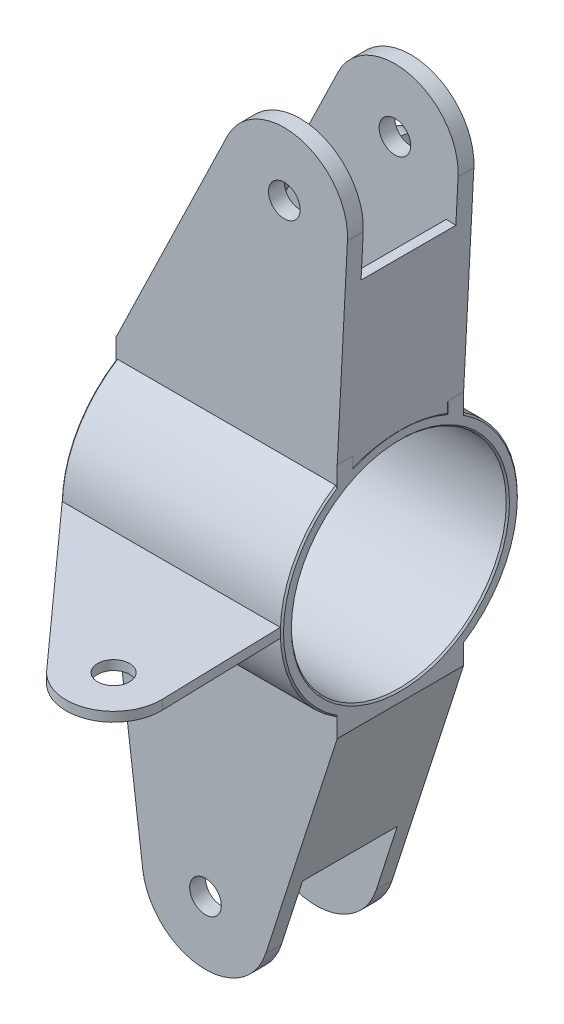
from build123d import *

# Parameters (mm, degrees)
SKETCH1_R             = 37.5
SKETCH1_R_2           = 34.007
BOSS_EXTRUDE1_DEPTH   = 35
BOSS_EXTRUDE2_START   = 15
SKETCH4_R             = 5.007
BOSS_EXTRUDE2_DEPTH   = 5
BOSS_EXTRUDE2_2_DEPTH = 5
BOSS_EXTRUDE3_START   = -15
SKETCH5_R             = 5.007
BOSS_EXTRUDE3_DEPTH   = 5
BOSS_EXTRUDE3_2_DEPTH = 5
BOSS_EXTRUDE4_DEPTH   = 70
CHAMFER1_SIZE         = 0.5
CHAMFER2_SIZE         = 0.5
BOSS_EXTRUDE8_DEPTH   = 3
SKETCH13_W            = 30
SKETCH13_H            = 55
BOSS_EXTRUDE9_DEPTH   = 3
BOSS_EXTRUDE10_DEPTH  = 3
SKETCH15_W            = 30
SKETCH15_H            = 50
BOSS_EXTRUDE11_DEPTH  = 3
BOSS_EXTRUDE12_DEPTH  = 3
SKETCH17_W            = 30
SKETCH17_H            = 52
BOSS_EXTRUDE13_DEPTH  = 3
BOSS_EXTRUDE14_DEPTH  = 3
SKETCH22_R            = 5.05
BOSS_EXTRUDE16_DEPTH  = 1.5
BOSS_EXTRUDE17_START  = -4
SKETCH23_R            = 3
BOSS_EXTRUDE17_DEPTH  = 4


with BuildPart() as part:
    # Sketch1 → Boss-Extrude1 (new, symmetric)
    with BuildSketch(Plane(origin=(0, 0, 0), x_dir=(0, 0, -1), z_dir=(1, 0, 0))):
        Circle(SKETCH1_R)
        Circle(SKETCH1_R_2, mode=Mode.SUBTRACT)
    extrude(amount=BOSS_EXTRUDE1_DEPTH, both=True)



with BuildPart() as body_2:
    # Sketch4 → Boss-Extrude2 (new body)
    with BuildSketch(Plane.XY.offset(BOSS_EXTRUDE2_START)):
        with BuildLine():
            Line((0.275652512, 110.319327951), (-35, 37.5))
            Line((-35, 37.5), (35, 37.5))
            Line((35, 37.5), (38.248437197, 100.571279081))
            ThreePointArc((38.248437197, 100.571279081), (23.247893056, 120.971872737), (0.275652512, 110.319327951))
        make_face()
        with Locations((18.274911388, 101.6)):
            Circle(SKETCH4_R, mode=Mode.SUBTRACT)
    extrude(amount=BOSS_EXTRUDE2_DEPTH)


with BuildPart() as body_3:
    # Sketch4 → Boss-Extrude2 2 (new body)
    with BuildSketch(Plane.XY.offset(BOSS_EXTRUDE2_START)):
        with BuildLine():
            Line((-35, -37.5), (-26.514661672, -104.126718952))
            ThreePointArc((-26.514661672, -104.126718952), (-8.523708177, -121.514365429), (12.360633821, -107.735798124))
            Line((12.360633821, -107.735798124), (35, -37.5))
            Line((35, -37.5), (-35, -37.5))
        make_face()
        with Locations((-6.674911388, -101.6)):
            Circle(SKETCH4_R, mode=Mode.SUBTRACT)
    extrude(amount=BOSS_EXTRUDE2_2_DEPTH)


with BuildPart() as body_4:
    # Sketch5 → Boss-Extrude3 (new body)
    with BuildSketch(Plane.XY.offset(BOSS_EXTRUDE3_START)):
        with BuildLine():
            Line((35, -37.5), (-35, -37.5))
            Line((-35, -37.5), (-26.514661672, -104.126718952))
            ThreePointArc((-26.514661672, -104.126718952), (-8.523708177, -121.514365429), (12.360633821, -107.735798124))
            Line((12.360633821, -107.735798124), (35, -37.5))
        make_face()
        with Locations((-6.674911388, -101.6)):
            Circle(SKETCH5_R, mode=Mode.SUBTRACT)
    extrude(amount=-BOSS_EXTRUDE3_DEPTH)


with BuildPart() as body_5:
    # Sketch5 → Boss-Extrude3 2 (new body)
    with BuildSketch(Plane.XY.offset(BOSS_EXTRUDE3_START)):
        with BuildLine():
            Line((35, 37.5), (38.248437197, 100.571279081))
            ThreePointArc((38.248437197, 100.571279081), (23.247893056, 120.971872737), (0.275652512, 110.319327951))
            Line((0.275652512, 110.319327951), (-35, 37.5))
            Line((-35, 37.5), (35, 37.5))
        make_face()
        with Locations((18.274911388, 101.6)):
            Circle(SKETCH5_R, mode=Mode.SUBTRACT)
    extrude(amount=-BOSS_EXTRUDE3_2_DEPTH)


with BuildPart() as part_1:
    add(part.part)

    add(body_2.part)  # Boss-Extrude4 merges body 2

    add(body_3.part)  # Boss-Extrude4 merges body 3

    add(body_4.part)  # Boss-Extrude4 merges body 4

    add(body_5.part)  # Boss-Extrude4 merges body 5
    # Sketch6 → Boss-Extrude4 (add)
    with BuildSketch(Plane(origin=(35, 0, 0), x_dir=(0, 0, -1), z_dir=(1, 0, 0))):
        with BuildLine():
            Line((20, -37.5), (15, -37.5))
            Line((15, -37.5), (15, -34.369317712))
            ThreePointArc((15, -34.369317712), (17.550008803, -33.139812779), (20, -31.721443851))
            Line((20, -31.721443851), (20, -37.5))
        make_face()
        with BuildLine():
            Line((-20, -37.5), (-15, -37.5))
            Line((-15, -37.5), (-15, -34.369317712))
            ThreePointArc((-15, -34.369317712), (-17.550008803, -33.139812779), (-20, -31.721443851))
            Line((-20, -31.721443851), (-20, -37.5))
        make_face()
        with BuildLine():
            Line((20, 37.5), (15, 37.5))
            Line((15, 37.5), (15, 34.369317712))
            ThreePointArc((15, 34.369317712), (17.550008803, 33.139812779), (20, 31.721443851))
            Line((20, 31.721443851), (20, 37.5))
        make_face()
        with BuildLine():
            Line((-20, 37.5), (-15, 37.5))
            Line((-15, 37.5), (-15, 34.369317712))
            ThreePointArc((-15, 34.369317712), (-17.550008803, 33.139812779), (-20, 31.721443851))
            Line((-20, 31.721443851), (-20, 37.5))
        make_face()
    extrude(amount=-BOSS_EXTRUDE4_DEPTH)

    # Chamfer1
    chamfer1_edges = [part_1.edges().sort_by_distance(p)[0] for p in [
        (35, -37.5, 0),
        (35, 37.5, 0),
        (35, 0, 34.007),
        (35, 0, 37.5),
        (35, 0, -37.5),
    ]]
    chamfer(chamfer1_edges, length=CHAMFER1_SIZE)

    # Chamfer2
    chamfer2_edges = [part_1.edges().sort_by_distance(p)[0] for p in [
        (-35, 0, -37.5),
        (-35, -37.5, 0),
        (-35, 37.5, 0),
        (-35, 0, 34.007),
        (-35, 0, 37.5),
    ]]
    chamfer(chamfer2_edges, length=CHAMFER2_SIZE)

    # Sketch12 → Boss-Extrude8 (add)
    with BuildSketch(Plane(origin=(32.981103177, -1.69866608, 0), x_dir=(0, 0, -1), z_dir=(0.9986762904840372, -0.05143604597014742, 0))):
        with BuildLine():
            Line((-15, 39.250622502), (-15, 88.751284357))
            Line((-15, 88.751284357), (15, 88.751284357))
            Line((15, 88.751284357), (15, 39.250622502))
            Line((15, 39.250622502), (15, 35.578558741))
            add(Edge.make_bspline(
                [(15, 35.578558741), (0, 42.22201753), (-15, 35.578558741)],
                knots=[1.153374055, 1.153374055, 1.153374055, 1.988218598, 1.988218598, 1.988218598], degree=2, weights=[1, 0.914137001, 1]))
            Line((-15, 35.578558741), (-15, 39.250622502))
        make_face()
    extrude(amount=-BOSS_EXTRUDE8_DEPTH)

    # Sketch13 → Boss-Extrude9 (add)
    with BuildSketch(Plane(origin=(-43.060925602, 20.859877331, 0), x_dir=(0, 0, 1), z_dir=(-0.8999629437964011, 0.435966397550678, 0))):
        with Locations((0, 45.989786478)):
            Rectangle(SKETCH13_W, SKETCH13_H)
    extrude(amount=-BOSS_EXTRUDE9_DEPTH)

    # Sketch14 → Boss-Extrude10 (add)
    with BuildSketch(Plane.ZY.offset(35)):
        with BuildLine():
            Line((15, 37.5), (15, 33.823069051))
            ThreePointArc((15, 33.823069051), (0, 37), (-15, 33.823069051))
            Line((-15, 33.823069051), (-15, 37.5))
            Line((-15, 37.5), (15, 37.5))
        make_face()
    extrude(amount=-BOSS_EXTRUDE10_DEPTH)

    # Sketch15 → Boss-Extrude11 (add)
    with BuildSketch(Plane(origin=(-39.141011091, -4.984857829, 0), x_dir=(0, 0, 1), z_dir=(-0.9919875142057744, -0.1263359476152713, 0))):
        with Locations((0, -57.777773616)):
            Rectangle(SKETCH15_W, SKETCH15_H)
    extrude(amount=-BOSS_EXTRUDE11_DEPTH)

    # Sketch16 → Boss-Extrude12 (add)
    with BuildSketch(Plane.ZY.offset(35)):
        with BuildLine():
            Line((15, -37.5), (-15, -37.5))
            Line((-15, -37.5), (-15, -33.823069051))
            ThreePointArc((-15, -33.823069051), (0, -37), (15, -33.823069051))
            Line((15, -33.823069051), (15, -37.5))
        make_face()
    extrude(amount=-BOSS_EXTRUDE12_DEPTH)

    # Sketch17 → Boss-Extrude13 (add)
    with BuildSketch(Plane(origin=(42.655635488, -13.749349722, 0), x_dir=(0, 0, -1), z_dir=(0.9517772604145124, -0.30678990621897206, 0))):
        with Locations((0, -50.954000548)):
            Rectangle(SKETCH17_W, SKETCH17_H)
    extrude(amount=-BOSS_EXTRUDE13_DEPTH)

    # Sketch19 → Boss-Extrude14 (add)
    with BuildSketch(Plane(origin=(35, 0, 0), x_dir=(0, 0, -1), z_dir=(1, 0, 0))):
        with BuildLine():
            Line((-15, -37.5), (-15, -33.823069051))
            ThreePointArc((-15, -33.823069051), (0, -37), (15, -33.823069051))
            Line((15, -33.823069051), (15, -37.5))
            Line((15, -37.5), (-15, -37.5))
        make_face()
    extrude(amount=-BOSS_EXTRUDE14_DEPTH)

    # Sketch23 → Boss-Extrude17 (add)
    with BuildSketch(Plane.ZY.offset(25.9).offset(BOSS_EXTRUDE17_START)):
        with BuildLine():
            Line((-20, 31.721443851), (-49.840187884, 58.154004142))
            ThreePointArc((-49.840187884, 58.154004142), (-62.874907522, 58.34887951), (-65.026564496, 45.491497789))
            Line((-65.026564496, 45.491497789), (-37.5, 0))
            ThreePointArc((-37.5, 0), (-32.834813841, 18.114220933), (-20, 31.721443851))
        make_face()
        with Locations((-56.470917013, 50.668455984)):
            Circle(SKETCH23_R, mode=Mode.SUBTRACT)
    extrude(amount=BOSS_EXTRUDE17_DEPTH)


with BuildPart() as body_2_2:
    # Sketch22 → Boss-Extrude16 (new, symmetric)
    with BuildSketch(Plane(origin=(0, 0, 0), x_dir=(1, 0, 0), z_dir=(0, 1, 0))):
        with BuildLine():
            Line((-34.5, -37.5), (34.5, -37.5))
            Line((34.5, -37.5), (35.532926057, -75.873692154))
            ThreePointArc((35.532926057, -75.873692154), (26.096971037, -90.209351988), (9.384212743, -86.306519652))
            Line((9.384212743, -86.306519652), (-34.5, -37.5))
        make_face()
        with Locations(Location((20.538357267, -76.277309318, 0), (0, 0, 270))):
            Circle(SKETCH22_R, mode=Mode.SUBTRACT)
    extrude(amount=BOSS_EXTRUDE16_DEPTH, both=True)


solid = Compound([part_1.part, body_2_2.part])
